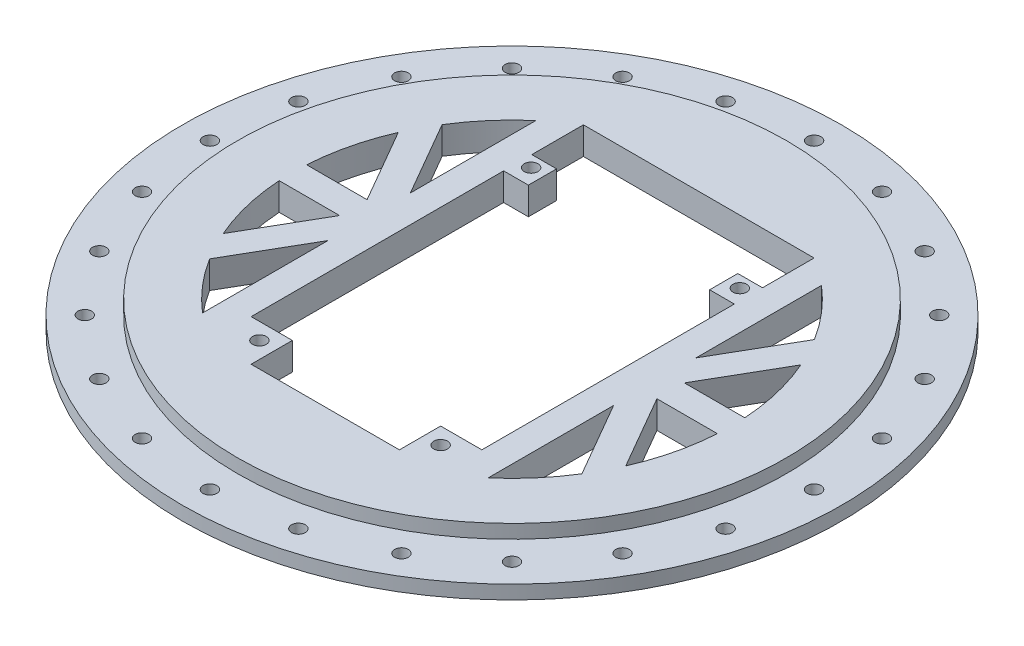
from build123d import *

# Parameters (mm, degrees)
SKETCH1_R           = 63.5
SKETCH1_R_2         = 1.5875
BOSS_EXTRUDE3_DEPTH = 6.35
SKETCH1_7_R         = 76.2
SKETCH1_7_R_2       = 1.5875
SKETCH1_7_R_3       = 63.5
BOSS_EXTRUDE4_DEPTH = 3.175


with BuildPart() as part:
    # Sketch1 → Boss-Extrude3 (new body)
    with BuildSketch(Plane(origin=(0, 0, 0), x_dir=(1, 0, 0), z_dir=(0, 1, 0))):
        Circle(SKETCH1_R)
        with BuildLine():
            Line((-50.652943399, -3.175), (-36.686174209, -3.175))
            Line((-36.686174209, -3.175), (-46.540477324, -20.243153668))
            ThreePointArc((-46.540477324, -20.243153668), (-49.340355951, -11.88825364), (-50.652943399, -3.175))
        make_face(mode=Mode.SUBTRACT)
        with Locations((-20.955, -37.4523)):
            Circle(SKETCH1_R_2, mode=Mode.SUBTRACT)
        with BuildLine():
            Line((-33.02, -9.525), (-33.02, -38.5419369))
            ThreePointArc((-33.02, -38.5419369), (-38.476065533, -33.096732181), (-43.04456039, -26.888047918))
            Line((-43.04456039, -26.888047918), (-33.02, -9.525))
        make_face(mode=Mode.SUBTRACT)
        with Locations((20.955, -37.4523)):
            Circle(SKETCH1_R_2, mode=Mode.SUBTRACT)
        with BuildLine():
            ThreePointArc((43.04456039, -26.888047918), (38.476065533, -33.096732181), (33.02, -38.5419369))
            Line((33.02, -38.5419369), (33.02, -9.525))
            Line((33.02, -9.525), (43.04456039, -26.888047918))
        make_face(mode=Mode.SUBTRACT)
        with BuildLine():
            Line((46.540477324, -20.243153668), (36.686174209, -3.175))
            Line((36.686174209, -3.175), (50.652943399, -3.175))
            ThreePointArc((50.652943399, -3.175), (49.340355951, -11.88825364), (46.540477324, -20.243153668))
        make_face(mode=Mode.SUBTRACT)
        with BuildLine():
            Line((-46.540477324, 20.243153668), (-36.686174209, 3.175))
            Line((-36.686174209, 3.175), (-50.652943399, 3.175))
            ThreePointArc((-50.652943399, 3.175), (-49.340355951, 11.88825364), (-46.540477324, 20.243153668))
        make_face(mode=Mode.SUBTRACT)
        with BuildLine():
            Line((-33.02, 38.5419369), (-33.02, 9.525))
            Line((-33.02, 9.525), (-43.04456039, 26.888047918))
            ThreePointArc((-43.04456039, 26.888047918), (-38.476065533, 33.096732181), (-33.02, 38.5419369))
        make_face(mode=Mode.SUBTRACT)
        with Locations((-24.13, 28.5496)):
            Circle(SKETCH1_R_2, mode=Mode.SUBTRACT)
        Polygon((17.145, -43.18), (-17.145, -43.18), (-17.145, -33.6423), (-26.67, -33.6423), (-26.67, 24.7396), (-20.955, 24.7396), (-20.955, 31.2547), (-26.67, 31.2547), (-26.67, 43.18), (26.67, 43.18), (26.67, 31.2547), (20.955, 31.2547), (20.955, 24.7396), (26.67, 24.7396), (26.67, -33.6423), (17.145, -33.6423), align=None, mode=Mode.SUBTRACT)
        with Locations((24.13, 28.5496)):
            Circle(SKETCH1_R_2, mode=Mode.SUBTRACT)
        with BuildLine():
            Line((43.04456039, 26.888047918), (33.02, 9.525))
            Line((33.02, 9.525), (33.02, 38.5419369))
            ThreePointArc((33.02, 38.5419369), (38.476065533, 33.096732181), (43.04456039, 26.888047918))
        make_face(mode=Mode.SUBTRACT)
        with BuildLine():
            Line((50.652943399, 3.175), (36.686174209, 3.175))
            Line((36.686174209, 3.175), (46.540477324, 20.243153668))
            ThreePointArc((46.540477324, 20.243153668), (49.340355951, 11.88825364), (50.652943399, 3.175))
        make_face(mode=Mode.SUBTRACT)
    extrude(amount=BOSS_EXTRUDE3_DEPTH)

    # Sketch1<7> → Boss-Extrude4 (add)
    with BuildSketch(Plane(origin=(0, 0, 0), x_dir=(1, 0, 0), z_dir=(0, 1, 0))):
        Circle(SKETCH1_7_R)
        with Locations((-49.391408666, -49.391408666)):
            Circle(SKETCH1_7_R_2, mode=Mode.SUBTRACT)
        with Locations((-34.925, -60.491874454)):
            Circle(SKETCH1_7_R_2, mode=Mode.SUBTRACT)
        with Locations((-18.0785103, -67.469918966)):
            Circle(SKETCH1_7_R_2, mode=Mode.SUBTRACT)
        with Locations((0, -69.85)):
            Circle(SKETCH1_7_R_2, mode=Mode.SUBTRACT)
        with Locations((-60.491874454, -34.925)):
            Circle(SKETCH1_7_R_2, mode=Mode.SUBTRACT)
        with Locations((-67.469918966, -18.0785103)):
            Circle(SKETCH1_7_R_2, mode=Mode.SUBTRACT)
        with Locations((-69.85, 0)):
            Circle(SKETCH1_7_R_2, mode=Mode.SUBTRACT)
        with Locations((18.0785103, -67.469918966)):
            Circle(SKETCH1_7_R_2, mode=Mode.SUBTRACT)
        with Locations((34.925, -60.491874454)):
            Circle(SKETCH1_7_R_2, mode=Mode.SUBTRACT)
        with Locations((49.391408666, -49.391408666)):
            Circle(SKETCH1_7_R_2, mode=Mode.SUBTRACT)
        with Locations((60.491874454, -34.925)):
            Circle(SKETCH1_7_R_2, mode=Mode.SUBTRACT)
        with Locations((67.469918966, -18.0785103)):
            Circle(SKETCH1_7_R_2, mode=Mode.SUBTRACT)
        with Locations((69.85, 0)):
            Circle(SKETCH1_7_R_2, mode=Mode.SUBTRACT)
        with Locations((-67.469918966, 18.0785103)):
            Circle(SKETCH1_7_R_2, mode=Mode.SUBTRACT)
        with Locations((-60.491874454, 34.925)):
            Circle(SKETCH1_7_R_2, mode=Mode.SUBTRACT)
        with Locations((-49.391408666, 49.391408666)):
            Circle(SKETCH1_7_R_2, mode=Mode.SUBTRACT)
        with Locations((-34.925, 60.491874454)):
            Circle(SKETCH1_7_R_2, mode=Mode.SUBTRACT)
        with Locations((-18.0785103, 67.469918966)):
            Circle(SKETCH1_7_R_2, mode=Mode.SUBTRACT)
        Circle(SKETCH1_7_R_3, mode=Mode.SUBTRACT)
        with Locations((67.469918966, 18.0785103)):
            Circle(SKETCH1_7_R_2, mode=Mode.SUBTRACT)
        with Locations((60.491874454, 34.925)):
            Circle(SKETCH1_7_R_2, mode=Mode.SUBTRACT)
        with Locations((0, 69.85)):
            Circle(SKETCH1_7_R_2, mode=Mode.SUBTRACT)
        with Locations((18.0785103, 67.469918966)):
            Circle(SKETCH1_7_R_2, mode=Mode.SUBTRACT)
        with Locations((34.925, 60.491874454)):
            Circle(SKETCH1_7_R_2, mode=Mode.SUBTRACT)
        with Locations((49.391408666, 49.391408666)):
            Circle(SKETCH1_7_R_2, mode=Mode.SUBTRACT)
    extrude(amount=BOSS_EXTRUDE4_DEPTH)


solid = part.part
